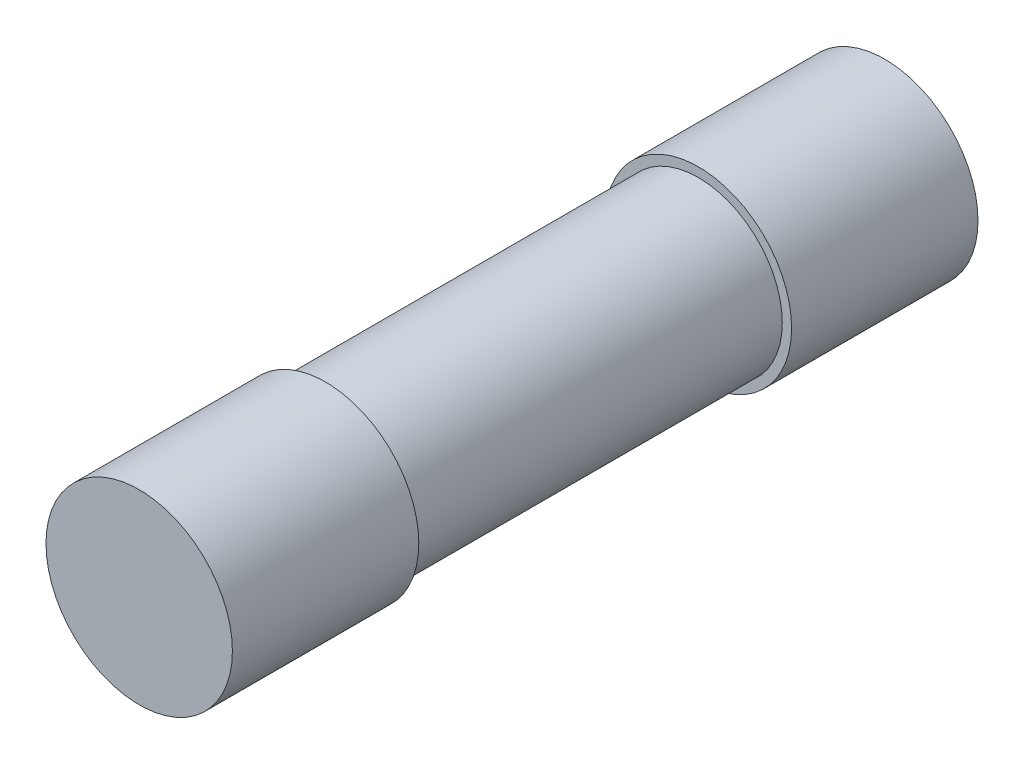
from build123d import *

# Parameters (mm, degrees)
EXTRUDE_START        = 10
SKETCH_1_R           = 2.5
EXTRUDE_1_DEPTH      = 5
EXTRUDE_2_DEPTH      = 6
EXTRUDE_2_DEPTH_BACK = 6
SKETCH_2_R           = 2.25


with BuildPart() as part:
    # Эскиз1 → Бобышка-Вытянуть1 (new body)
    with BuildSketch(Plane.XY.offset(EXTRUDE_START)):
        Circle(SKETCH_1_R)
    extrude_1 = extrude(amount=-EXTRUDE_1_DEPTH)

    # Эскиз2 → Бобышка-Вытянуть2 (add, two sides: drawn at the far end of the back side and taken through both)
    with BuildSketch(Plane.XY.offset(-EXTRUDE_2_DEPTH_BACK)):
        Circle(SKETCH_2_R)
    extrude(amount=EXTRUDE_2_DEPTH + EXTRUDE_2_DEPTH_BACK)

    # Зеркальное отражение1: Бобышка-Вытянуть1 across plane
    add(extrude_1.mirror(Plane.XY))


solid = part.part
